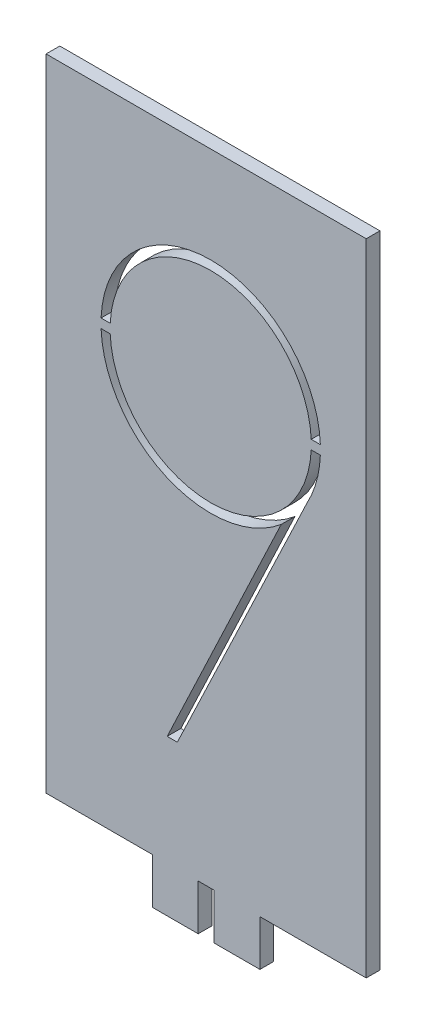
from build123d import *

# Parameters (mm, degrees)
SKIZZE1_W                        = 35
SKIZZE1_H                        = 75
AUFSATZ_LINEAR_AUSTRAGEN1_DEPTH  = 1.5
SKIZZE2_W                        = 11.63
SKIZZE2_H                        = 5
SKIZZE2_W_2                      = 11.62
SKIZZE2_W_3                      = 1.75
SCHNITT_LINEAR_AUSTRAGEN1_DEPTH  = 1.5
SKIZZE13_R                       = 12
SKIZZE13_R_2                     = 11
SCHNITT_LINEAR_AUSTRAGEN10_DEPTH = 20
SKIZZE14_W                       = 27.206049555
SKIZZE14_H                       = 1
AUFSATZ_LINEAR_AUSTRAGEN2_DEPTH  = 1.5
SCHNITT_LINEAR_AUSTRAGEN11_DEPTH = 20


with BuildPart() as part:
    # Skizze1 → Aufsatz-Linear austragen1 (new body)
    with BuildSketch(Plane.XY):
        with Locations((17.5, 37.5)):
            Rectangle(SKIZZE1_W, SKIZZE1_H)
    extrude(amount=AUFSATZ_LINEAR_AUSTRAGEN1_DEPTH)

    # Skizze2 → Schnitt-Linear austragen1 (cut)
    with BuildSketch(Plane.XY.offset(1.5)):
        with Locations((5.815, 2.5)):
            Rectangle(SKIZZE2_W, SKIZZE2_H)
        with Locations((29.19, 2.5)):
            Rectangle(SKIZZE2_W_2, SKIZZE2_H)
        with Locations((17.505, 2.5)):
            Rectangle(SKIZZE2_W_3, SKIZZE2_H)
    extrude(amount=-SCHNITT_LINEAR_AUSTRAGEN1_DEPTH, mode=Mode.SUBTRACT)

    # Skizze13 → Schnitt-Linear austragen10 (cut)
    with BuildSketch(Plane.XY.offset(1.5)):
        with Locations((18, 52.5)):
            Circle(SKIZZE13_R)
        with Locations((18, 52.5)):
            Circle(SKIZZE13_R_2, mode=Mode.SUBTRACT)
    extrude(amount=-SCHNITT_LINEAR_AUSTRAGEN10_DEPTH, mode=Mode.SUBTRACT)


with BuildPart() as schnitt_linear_austragen10_piece_1:
    # of the separate pieces the step leaves, piece 1, a body of its own (schnitt_linear_austragen10_pieces)
    add(part.part.solids().sort_by_distance((11.63, 0, 0))[0])



with BuildPart() as schnitt_linear_austragen10_piece_2:
    # of the separate pieces the step leaves, piece 2, a body of its own (schnitt_linear_austragen10_pieces)
    add(part.part.solids().sort_by_distance((29, 52.5, 0))[0])


with BuildPart() as schnitt_linear_austragen10_piece_1_1:
    add(schnitt_linear_austragen10_piece_1.part)

    add(schnitt_linear_austragen10_piece_2.part)  # Aufsatz-Linear austragen2 merges Schnitt-Linear austragen10 piece 2
    # Skizze14 → Aufsatz-Linear austragen2 (add)
    with BuildSketch(Plane.XY.offset(1.5)):
        with Locations((18.390255325, 52.5)):
            Rectangle(SKIZZE14_W, SKIZZE14_H)
    extrude(amount=-AUFSATZ_LINEAR_AUSTRAGEN2_DEPTH)

    # Skizze15 → Schnitt-Linear austragen11 (cut)
    with BuildSketch(Plane.XY.offset(1.5)):
        Polygon((14.347795458, 17), (13.241164508, 17), (27.231585845, 46.518543423), (29.406174437, 48.771838964), (29.283539592, 48.415672114), (28.532345142, 46.749373442), align=None)
    extrude(amount=-SCHNITT_LINEAR_AUSTRAGEN11_DEPTH, mode=Mode.SUBTRACT)


solid = schnitt_linear_austragen10_piece_1_1.part
